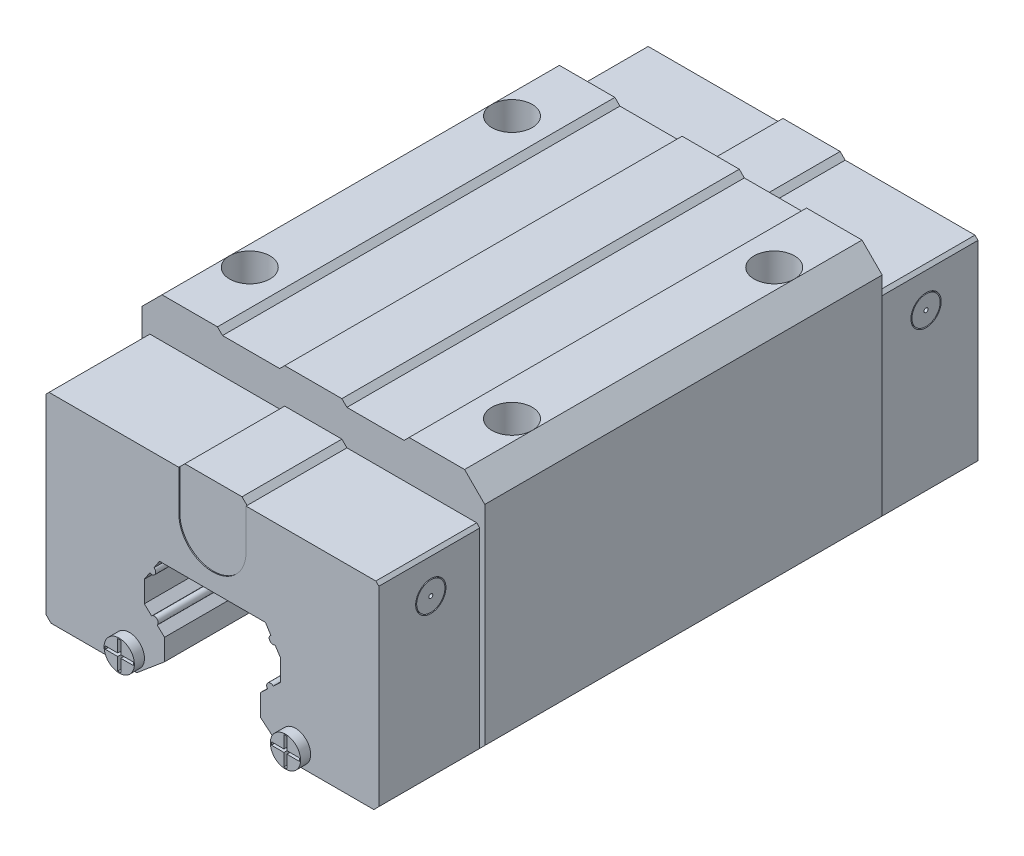
from build123d import *

# Parameters (mm, degrees)
SKETCH_1_R           = 1.5
EXTRUDE_11_DEPTH     = 29.7
SKETCH_1_12_R        = 1.5
EXTRUDE_12_DEPTH     = 30.7
EXTRUDE_13_DEPTH     = 19.7
CUT_EXTRUDE_1_DEPTH  = 0.5
CUT_EXTRUDE_6_DEPTH  = 0.1
SKETCH_13_R          = 1.5
SKETCH_13_R_2        = 1.4
SKETCH_13_R_3        = 0.2
CUT_EXTRUDE_9_DEPTH  = 5
SKETCH_14_R          = 2
CUT_EXTRUDE_10_DEPTH = 5


with BuildPart() as part:
    # 草图1 → 凸台-拉伸11 (new, symmetric)
    with BuildSketch(Plane.XY):
        with BuildLine():
            Line((-16.5, 19.425), (-16.5, 0.5))
            Line((-16.5, 0.5), (-16, 0))
            Line((-16, 0), (-7.5, 0))
            Line((-7.5, 0), (-4.75, 2.307523986))
            Line((-4.75, 2.307523986), (-4.75, 4.418193206))
            Line((-4.75, 4.418193206), (-5.476477728, 5.099554443))
            ThreePointArc((-5.476477728, 5.099554443), (-5.493464298, 5.629612418), (-6.023522272, 5.612625848))
            Line((-6.023522272, 5.612625848), (-6.75, 6.293987085))
            Line((-6.75, 6.293987085), (-6.75, 8.404656305))
            Line((-6.75, 8.404656305), (-6.205141704, 9.238414341))
            ThreePointArc((-6.205141704, 9.238414341), (-5.686086188, 9.347186448), (-5.794858296, 9.866241964))
            Line((-5.794858296, 9.866241964), (-5.25, 10.7))
            Line((-5.25, 10.7), (5.25, 10.7))
            Line((5.25, 10.7), (5.794858296, 9.866241964))
            ThreePointArc((5.794858296, 9.866241964), (5.686086188, 9.347186448), (6.205141704, 9.238414341))
            Line((6.205141704, 9.238414341), (6.75, 8.404656305))
            Line((6.75, 8.404656305), (6.75, 6.293987085))
            Line((6.75, 6.293987085), (6.023522272, 5.612625848))
            ThreePointArc((6.023522272, 5.612625848), (5.493464298, 5.629612418), (5.476477728, 5.099554443))
            Line((5.476477728, 5.099554443), (4.75, 4.418193206))
            Line((4.75, 4.418193206), (4.75, 2.307523986))
            Line((4.75, 2.307523986), (7.5, 0))
            Line((7.5, 0), (16, 0))
            Line((16, 0), (16.5, 0.5))
            Line((16.5, 0.5), (16.5, 19.425))
            Line((16.5, 19.425), (16.2, 19.725))
            Line((16.2, 19.725), (3.333333333, 19.725))
            Line((3.333333333, 19.725), (2.833333333, 20.225))
            Line((2.833333333, 20.225), (-2.833333333, 20.225))
            Line((-2.833333333, 20.225), (-3.333333333, 19.725))
            Line((-3.333333333, 19.725), (-16.2, 19.725))
            Line((-16.2, 19.725), (-16.5, 19.425))
        make_face()
        with Locations((-8.237924758, 1.6)):
            Circle(SKETCH_1_R, mode=Mode.SUBTRACT)
        with Locations((8.237924758, 1.6)):
            Circle(SKETCH_1_R, mode=Mode.SUBTRACT)
    extrude(amount=EXTRUDE_11_DEPTH, both=True)

    # 草图1<12> → 凸台-拉伸12 (add, symmetric)
    with BuildSketch(Plane.XY):
        with Locations((8.237924758, 1.6)):
            Circle(SKETCH_1_12_R)
        with Locations((-8.237924758, 1.6)):
            Circle(SKETCH_1_12_R)
    extrude(amount=EXTRUDE_12_DEPTH, both=True)

    # 草图1<13> → 凸台-拉伸13 (add, symmetric)
    with BuildSketch(Plane.XY):
        Polygon((-15, 23.7), (-17, 21.7), (-17, 17.7), (-16.75, 17.45), (-16.75, 0.75), (-16.5, 0.5), (-16.5, 19.425), (-16.2, 19.725), (-3.333333333, 19.725), (-2.833333333, 20.225), (2.833333333, 20.225), (3.333333333, 19.725), (16.2, 19.725), (16.5, 19.425), (16.5, 0.5), (17, 1), (17, 21.7), (15, 23.7), (9.5, 23.7), (9, 23.2), (3.333333333, 23.2), (2.833333333, 23.7), (-2.833333333, 23.7), (-3.333333333, 23.2), (-9, 23.2), (-9.5, 23.7), align=None)
    extrude(amount=EXTRUDE_13_DEPTH, both=True)

    # 草图4 → 切除-拉伸1 (cut)
    with BuildSketch(Plane.XY.offset(30.7)):
        with BuildLine():
            Line((8.087924758, 1.75), (6.845983667, 1.75))
            ThreePointArc((6.845983667, 1.75), (6.837924758, 1.6), (6.845983667, 1.45))
            Line((6.845983667, 1.45), (8.087924758, 1.45))
            Line((8.087924758, 1.45), (8.087924758, 0.208058909))
            ThreePointArc((8.087924758, 0.208058909), (8.237924758, 0.2), (8.387924758, 0.208058909))
            Line((8.387924758, 0.208058909), (8.387924758, 1.45))
            Line((8.387924758, 1.45), (9.629865848, 1.45))
            ThreePointArc((9.629865848, 1.45), (9.637924758, 1.6), (9.629865848, 1.75))
            Line((9.629865848, 1.75), (8.387924758, 1.75))
            Line((8.387924758, 1.75), (8.387924758, 2.991941091))
            ThreePointArc((8.387924758, 2.991941091), (8.237924758, 3), (8.087924758, 2.991941091))
            Line((8.087924758, 2.991941091), (8.087924758, 1.75))
        make_face()
        with BuildLine():
            Line((-8.087924758, 2.991941091), (-8.087924758, 1.75))
            Line((-8.087924758, 1.75), (-6.845983667, 1.75))
            ThreePointArc((-6.845983667, 1.75), (-6.837924758, 1.6), (-6.845983667, 1.45))
            Line((-6.845983667, 1.45), (-8.087924758, 1.45))
            Line((-8.087924758, 1.45), (-8.087924758, 0.208058909))
            ThreePointArc((-8.087924758, 0.208058909), (-8.237924758, 0.2), (-8.387924758, 0.208058909))
            Line((-8.387924758, 0.208058909), (-8.387924758, 1.45))
            Line((-8.387924758, 1.45), (-9.629865848, 1.45))
            ThreePointArc((-9.629865848, 1.45), (-9.637924758, 1.6), (-9.629865848, 1.75))
            Line((-9.629865848, 1.75), (-8.387924758, 1.75))
            Line((-8.387924758, 1.75), (-8.387924758, 2.991941091))
            ThreePointArc((-8.387924758, 2.991941091), (-8.237924758, 3), (-8.087924758, 2.991941091))
        make_face()
    cut_extrude_1 = extrude(amount=-CUT_EXTRUDE_1_DEPTH, mode=Mode.SUBTRACT)

    # 镜向1: 切除-拉伸1 across plane
    add(cut_extrude_1.mirror(Plane.XY), mode=Mode.SUBTRACT)

    # 草图8 → 切除-拉伸6 (cut)
    with BuildSketch(Plane.XY.offset(29.7)):
        with BuildLine():
            Line((3.333333333, 15.75), (3.333333333, 19.725))
            Line((3.333333333, 19.725), (2.833333333, 20.225))
            Line((2.833333333, 20.225), (-2.833333333, 20.225))
            Line((-2.833333333, 20.225), (-3.333333333, 19.725))
            Line((-3.333333333, 19.725), (-3.333333333, 15.75))
            ThreePointArc((-3.333333333, 15.75), (0, 12.416666667), (3.333333333, 15.75))
        make_face()
    extrude(amount=-CUT_EXTRUDE_6_DEPTH, mode=Mode.SUBTRACT)

    # 草图13 → 切除-拉伸9 (cut)
    # profile 1 of 4: a face of its own
    with BuildSketch(Plane(origin=(16.5, 0, 0), x_dir=(0, 0, -1), z_dir=(1, 0, 0))):
        with Locations((-24.55, 16)):
            Circle(SKETCH_13_R)
        with Locations((-24.55, 16)):
            Circle(SKETCH_13_R_2, mode=Mode.SUBTRACT)
    # profile 2 of 4: a face of its own
    with BuildSketch(Plane(origin=(16.5, 0, 0), x_dir=(0, 0, -1), z_dir=(1, 0, 0))):
        with Locations((24.55, 16)):
            Circle(SKETCH_13_R)
        with Locations((24.55, 16)):
            Circle(SKETCH_13_R_2, mode=Mode.SUBTRACT)
    # profile 3 of 4: a face of its own
    with BuildSketch(Plane(origin=(16.5, 0, 0), x_dir=(0, 0, -1), z_dir=(1, 0, 0))):
        with Locations((-24.55, 16)):
            Circle(SKETCH_13_R_3)
    # profile 4 of 4: a face of its own
    with BuildSketch(Plane(origin=(16.5, 0, 0), x_dir=(0, 0, -1), z_dir=(1, 0, 0))):
        with Locations((24.55, 16)):
            Circle(SKETCH_13_R_3)
    extrude(amount=-CUT_EXTRUDE_9_DEPTH, mode=Mode.SUBTRACT)

    # 草图14 → 切除-拉伸10 (cut)
    with BuildSketch(Plane(origin=(0, 23.7, 0), x_dir=(1, 0, 0), z_dir=(0, 1, 0))):
        with Locations((-13, 13)):
            Circle(SKETCH_14_R)
        with Locations((13, 13)):
            Circle(SKETCH_14_R)
        with Locations((13, -13)):
            Circle(SKETCH_14_R)
        with Locations((-13, -13)):
            Circle(SKETCH_14_R)
    extrude(amount=-CUT_EXTRUDE_10_DEPTH, mode=Mode.SUBTRACT)


solid = part.part
